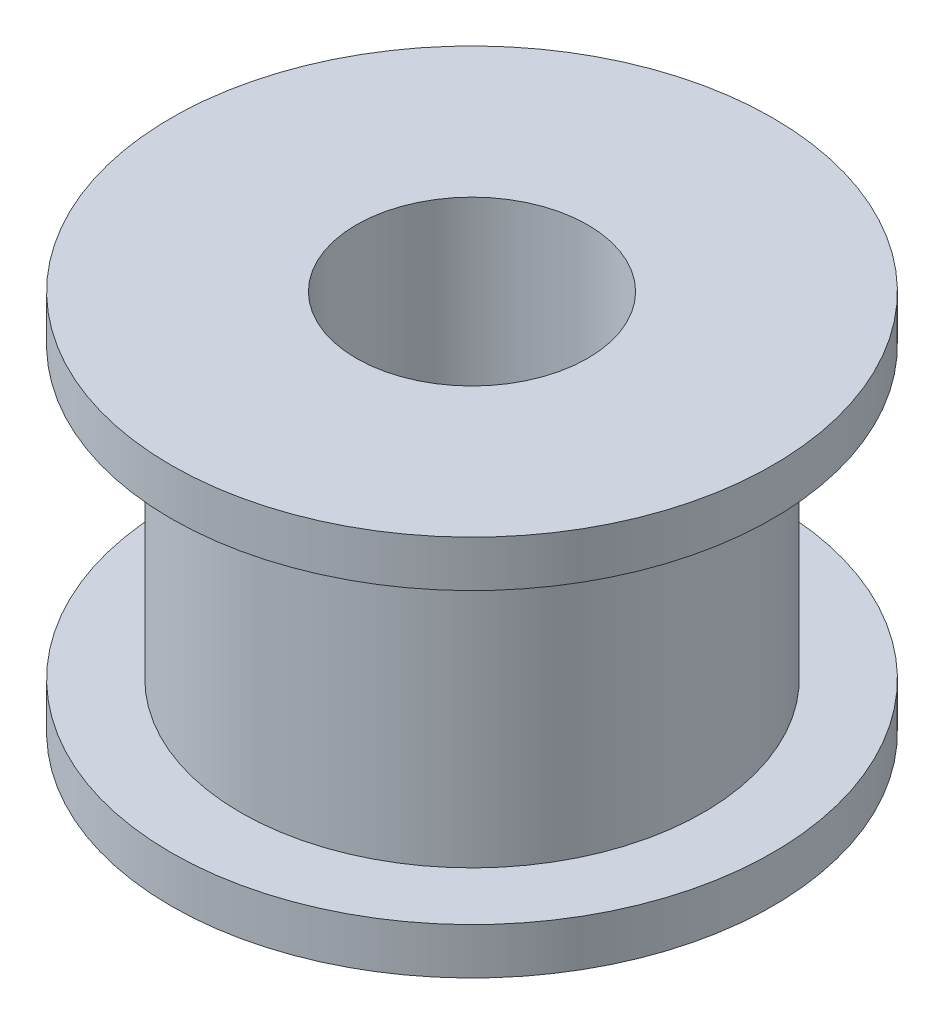
from build123d import *


with BuildPart() as part:
    # Esquisse1 → Révolution1 (revolve)
    with BuildSketch(Plane.XY, mode=Mode.PRIVATE) as r_volution1_sk:
        Polygon((-2.5, -8.25), (-2.5, 0), (-6.5, 0), (-6.5, -1), (-5, -1), (-5, -7.25), (-6.5, -7.25), (-6.5, -8.25), align=None)
    revolve(r_volution1_sk.sketch.rotate(Axis((0, 0, 0), (0, -1, 0)), 270), axis=Axis((0, 0, 0), (0, -1, 0)))


solid = part.part
